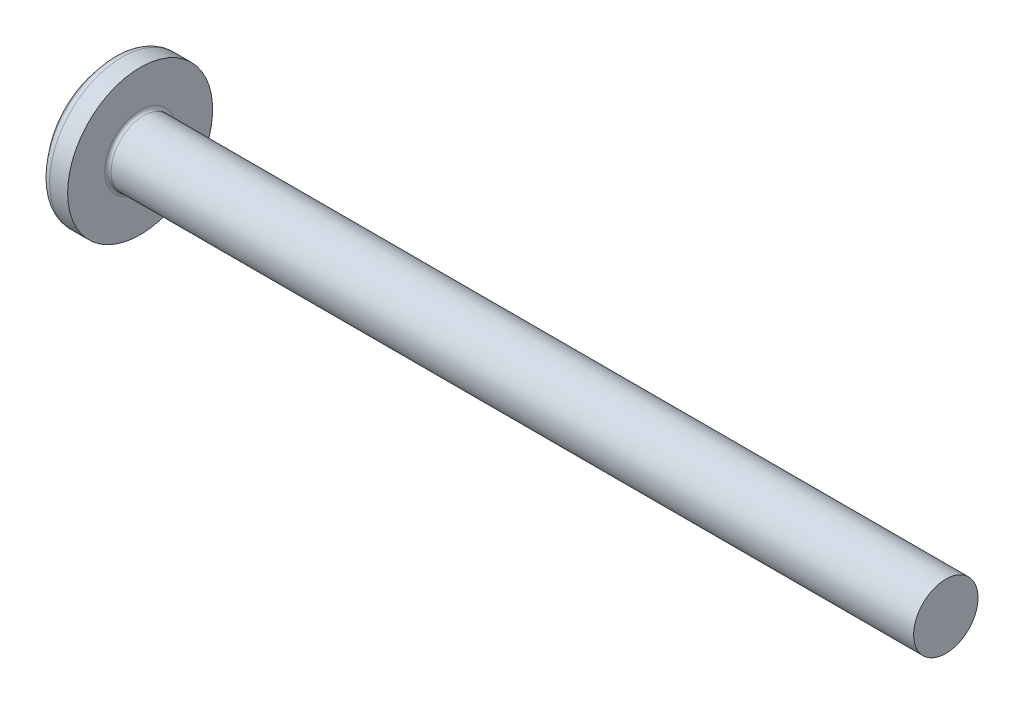
from build123d import *

# Parameters (mm, degrees)
FILLET1_R    = 0.1
RECPAT_COUNT = 2
RECPAT_ANGLE = 90


with BuildPart() as part:
    # BodySke → Base-Revolve (revolve)
    with BuildSketch(Plane.XY, mode=Mode.PRIVATE) as base_revolve_sk:
        with BuildLine():
            Line((1.6, 1), (1.6, 2.25))
            Line((1.6, 2.25), (1.040254645, 2.25))
            ThreePointArc((1.040254645, 2.25), (0.931542827, 2.227147204), (0.841233742, 2.162457338))
            ThreePointArc((0.841233742, 2.162457338), (0.217714632, 1.16016119), (0, 0))
            Line((0, 0), (26.6, 0))
            Line((26.6, 0), (26.6, 1))
            Line((26.6, 1), (1.6, 1))
        make_face()
    revolve(base_revolve_sk.sketch.rotate(Axis((-25.4, 0, 0), (1, 0, 0)), 90), axis=Axis((-25.4, 0, 0), (1, 0, 0)))

    # Fillet1
    fillet1_edges = [part.edges().sort_by_distance(p)[0] for p in [
        (1.6, 0, -1),
    ]]
    fillet(fillet1_edges, radius=FILLET1_R)

    # Sketch3 → Recess section 0
    with BuildSketch(Plane(origin=(0, 0, 0), x_dir=(0, 0, -1), z_dir=(1, 0, 0))):
        with BuildLine():
            Line((0.37, -0.95), (-0.37, -0.95))
            Line((-0.37, -0.95), (-0.37, 0.95))
            Line((-0.37, 0.95), (0.37, 0.95))
            Line((0.37, 0.95), (0.37, -0.95))
        make_face()
    # Sketch4 → Recess section 1
    with BuildSketch(Plane(origin=(1.75, 0, 0), x_dir=(0, 0, -1), z_dir=(1, 0, 0))):
        with BuildLine():
            Line((0.37, -0.527482216), (-0.37, -0.527482216))
            Line((-0.37, -0.527482216), (-0.37, 0.527482216))
            Line((-0.37, 0.527482216), (0.37, 0.527482216))
            Line((0.37, 0.527482216), (0.37, -0.527482216))
        make_face()
    recess = loft(mode=Mode.SUBTRACT)

    # RecPat: Recess ×2 about axis
    recpat_axis = Axis((0, 0, 0), (1, 0, 0))
    for i in range(1, RECPAT_COUNT):
        add(recess.rotate(recpat_axis, i * RECPAT_ANGLE / (RECPAT_COUNT - 1)), mode=Mode.SUBTRACT)

    # RecCorSke → RecessCore (revolve, cut)
    with BuildSketch(Plane.XY, mode=Mode.PRIVATE) as recesscore_sk:
        Polygon((0, 0), (0, 0.678371921), (1.75, 0.556), (1.930655351, 0), align=None)
    revolve(recesscore_sk.sketch.rotate(Axis((-3.175, 0, 0), (1, 0, 0)), 22.071251507), axis=Axis((-3.175, 0, 0), (1, 0, 0)), mode=Mode.SUBTRACT)


solid = part.part
